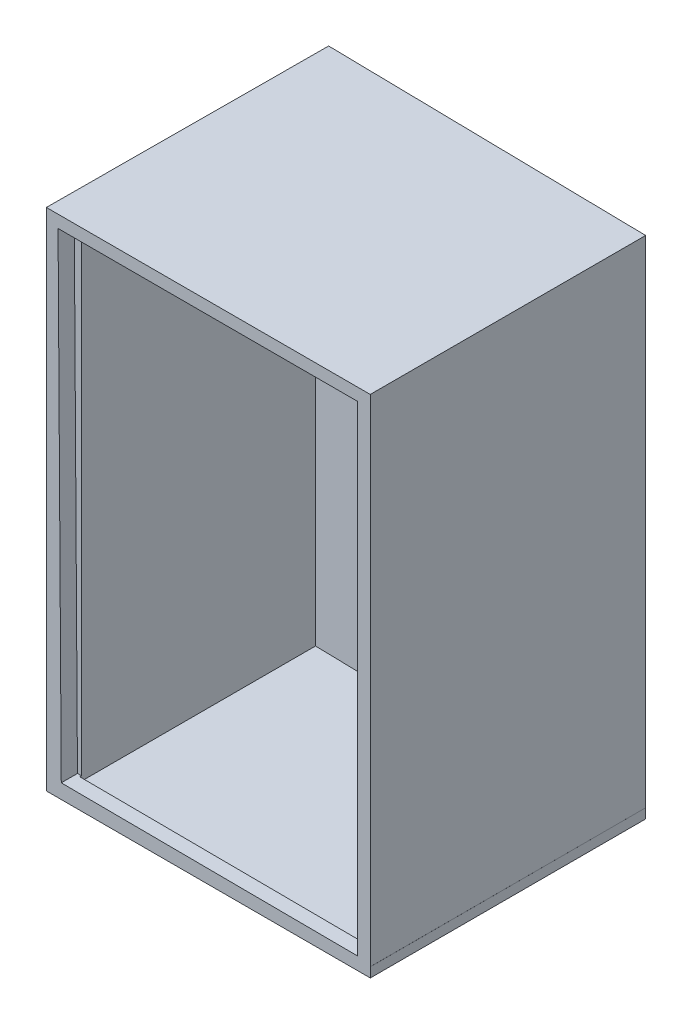
from build123d import *

# Parameters (mm, degrees)
BOSS_EXTRUDE1_DEPTH  = 3
BOSS_EXTRUDE3_DEPTH  = 150
BOSS_EXTRUDE4_DEPTH  = 3
CUT_EXTRUDE1_DEPTH   = 5
SKETCH6_W            = 55.881383125
SKETCH6_H            = 131.694311499
CUT_EXTRUDE3_DEPTH   = 19
SKETCH7_W            = 11.810965499
SKETCH7_H            = 56.555160504
BOSS_EXTRUDE5_DEPTH  = 1
SKETCH8_W            = 9.430572128
SKETCH8_H            = 6.978385349
CUT_EXTRUDE4_DEPTH   = 1
SKETCH9_R            = 2.553462054
SKETCH9_R_2          = 2.527406692
SKETCH9_R_3          = 2.450578881
SKETCH9_R_4          = 2.393474957
SKETCH9_R_5          = 2.423501959
SKETCH9_R_6          = 2.218374128
SKETCH9_R_7          = 2.394320802
SKETCH9_R_8          = 2.316573099
SKETCH9_R_9          = 2.249840859
BOSS_EXTRUDE6_DEPTH  = 1
SKETCH10_W           = 5.275039684
SKETCH10_H           = 138.164085468
BOSS_EXTRUDE8_DEPTH  = 28
SKETCH11_W           = 5.203423545
SKETCH11_H           = 131.656440026
BOSS_EXTRUDE9_DEPTH  = 28
BOSS_EXTRUDE11_DEPTH = 1
BOSS_EXTRUDE12_DEPTH = 1
BOSS_EXTRUDE13_DEPTH = 1
BOSS_EXTRUDE14_DEPTH = 1
BOSS_EXTRUDE16_DEPTH = 1
BOSS_EXTRUDE17_DEPTH = 1
BOSS_EXTRUDE18_DEPTH = 1
BOSS_EXTRUDE19_DEPTH = 1
SKETCH24_R           = 0.207284526
BOSS_EXTRUDE20_DEPTH = 1
BOSS_EXTRUDE21_DEPTH = 1


with BuildPart() as part:
    # Sketch1 → Boss-Extrude1 (new body)
    with BuildSketch(Plane(origin=(0, 0, 0), x_dir=(1, 0, 0), z_dir=(0, 1, 0))):
        Polygon((-39.384781927, 34.745621882), (60.600258914, 33.015995311), (60.615218073, -51.984003373), (-39.384781927, -51.984003373), align=None)
    extrude(amount=BOSS_EXTRUDE1_DEPTH)

    # Sketch2 → Boss-Extrude3 (add)
    with BuildSketch(Plane(origin=(0, 3, 0), x_dir=(1, 0, 0), z_dir=(0, 1, 0))):
        Polygon((-39.384781927, 34.745621882), (60.600258914, 33.015995311), (60.595836951, -51.984003373), (-39.384781927, -51.984003373), align=None)
        Polygon((-33.590728292, 25.303502533), (54.790044156, 23.384540531), (54.790044156, -47.497414334), (-33.590728292, -47.497414334), align=None, mode=Mode.SUBTRACT)
    extrude(amount=BOSS_EXTRUDE3_DEPTH)

    # Sketch4 → Boss-Extrude4 (add)
    with BuildSketch(Plane(origin=(0, 153, 0), x_dir=(1, 0, 0), z_dir=(0, 1, 0))):
        Polygon((-38.96845801, 34.738419955), (60.600258914, 33.015995311), (60.595836951, -51.984003373), (-39.384781927, -51.984003373), align=None)
    extrude(amount=BOSS_EXTRUDE4_DEPTH)

    # Sketch5 → Cut-Extrude1 (cut)
    with BuildSketch(Plane.XY.offset(51.984003373)):
        Polygon((-35.776536927, 152.183917826), (56.654094714, 152.183917826), (56.654094714, 3.919369827), (-34.786647076, 4.474634491), align=None)
    extrude(amount=-CUT_EXTRUDE1_DEPTH, mode=Mode.SUBTRACT)

    # Sketch6 → Cut-Extrude3 (cut)
    with BuildSketch(Plane(origin=(0.533313623, 0, -24.562586404), x_dir=(0.999764368337665, 0, 0.021707321400619532), z_dir=(-0.021707321400619536, 0, 0.999764368337665))):
        with Locations((10.253451121, 68.969395882)):
            Rectangle(SKETCH6_W, SKETCH6_H)
    extrude(amount=-CUT_EXTRUDE3_DEPTH, mode=Mode.SUBTRACT)

    # Sketch7 → Boss-Extrude5 (add)
    with BuildSketch(Plane(origin=(0.533313623, 0, -24.562586404), x_dir=(0.999764368337665, 0, 0.021707321400619532), z_dir=(-0.021707321400619536, 0, 0.999764368337665))):
        with Locations((46.937117149, 62.880310934)):
            Rectangle(SKETCH7_W, SKETCH7_H)
    extrude(amount=BOSS_EXTRUDE5_DEPTH)

    # Sketch8 → Cut-Extrude4 (cut)
    with BuildSketch(Plane(origin=(0.511606302, 0, -23.562822036), x_dir=(0.9997643683376649, 0, 0.02170732140061971), z_dir=(-0.021707321400619713, 0, 0.999764368337665))):
        with Locations((47.04819366, 84.912097217)):
            Rectangle(SKETCH8_W, SKETCH8_H)
    extrude(amount=-CUT_EXTRUDE4_DEPTH, mode=Mode.SUBTRACT)

    # Sketch9 → Boss-Extrude6 (add)
    with BuildSketch(Plane(origin=(0.511606302, 0, -23.562822036), x_dir=(0.9997643683376649, 0, 0.02170732140061971), z_dir=(-0.021707321400619713, 0, 0.999764368337665))):
        with Locations((44.220057391, 76.932607019)):
            Circle(SKETCH9_R)
        with Locations((49.787987313, 76.932607019)):
            Circle(SKETCH9_R_2)
        with Locations((44.220057391, 71.009067158)):
            Circle(SKETCH9_R_3)
        with Locations((49.997997577, 71.009067158)):
            Circle(SKETCH9_R_4)
        with Locations((46.605113113, 64.043550264)):
            Circle(SKETCH9_R_5)
        with Locations((46.605113113, 57.223700245)):
            Circle(SKETCH9_R_6)
        with Locations((46.605113113, 50.771174031)):
            Circle(SKETCH9_R_7)
        with Locations((46.605113113, 43.775541059)):
            Circle(SKETCH9_R_8)
        with Locations((46.605113113, 37.775832891)):
            Circle(SKETCH9_R_9)
    extrude(amount=BOSS_EXTRUDE6_DEPTH)

    # Sketch10 → Boss-Extrude8 (add)
    with BuildSketch(Plane(origin=(-17.683072767, 0, -0.383942613), x_dir=(0.021707321400619536, 0, -0.999764368337665), z_dir=(0.999764368337665, 0, 0.02170732140061954))):
        with Locations((31.343991402, 72.204282866)):
            Rectangle(SKETCH10_W, SKETCH10_H)
    extrude(amount=BOSS_EXTRUDE8_DEPTH)

    # Sketch11 → Boss-Extrude9 (add)
    with BuildSketch(Plane(origin=(10.310329546, 0, 0.223862386), x_dir=(0.021707321400619456, 0, -0.999764368337665), z_dir=(0.9997643683376649, 0, 0.021707321400619452))):
        with Locations((31.472273281, 68.988331618)):
            Rectangle(SKETCH11_W, SKETCH11_H)
    extrude(amount=BOSS_EXTRUDE9_DEPTH)

    # Sketch16 → Boss-Extrude11 (add)
    with BuildSketch(Plane(origin=(0.48989898, 0, -22.563057667), x_dir=(0.9997643683376649, 0, 0.021707321400619713), z_dir=(-0.021707321400619716, 0, 0.999764368337665))):
        with BuildLine():
            add(Edge.make_bspline(
                [(45.511628238, 63.885796638), (45.511956256, 63.941894026), (45.512593436, 64.05086401), (45.519681857, 64.209648652), (45.531457199, 64.358608941), (45.547594572, 64.497752007), (45.567232552, 64.627113772), (45.593448039, 64.746348529), (45.623260841, 64.856008136), (45.657813287, 64.956450184), (45.696801076, 65.049027887), (45.739235337, 65.135453088), (45.786800131, 65.215595021), (45.836777044, 65.290732811), (45.891189116, 65.359636506), (45.948487906, 65.423279169), (46.010909783, 65.480189919), (46.076332791, 65.532036221), (46.145349255, 65.577485693), (46.215991921, 65.617518432), (46.288747027, 65.651718299), (46.36381321, 65.678608735), (46.440515768, 65.700819582), (46.519122835, 65.716008529), (46.599764199, 65.725565438), (46.654195634, 65.726479105), (46.681800513, 65.726942472)],
                knots=[0, 0, 0, 0, 1.646270934, 3.197905019, 4.663502075, 6.030701355, 7.308322542, 8.50163776, 9.611534131, 10.641858119, 11.616356847, 12.558055219, 13.465016945, 14.349605745, 15.204443733, 16.039544428, 16.859896111, 17.680448484, 18.487036065, 19.28249412, 20.06191084, 20.843045899, 21.620316918, 22.403196591, 23.190181807, 24, 24, 24, 24], degree=3))
            add(Edge.make_bspline(
                [(46.681800513, 65.726942472), (46.709635992, 65.726454656), (46.764992001, 65.725484546), (46.846832376, 65.716160603), (46.926782058, 65.70068948), (47.004500196, 65.678768505), (47.080625183, 65.651572829), (47.15456159, 65.617485712), (47.226768672, 65.577806844), (47.29609896, 65.531182967), (47.363313575, 65.479200691), (47.426761538, 65.420438022), (47.486448624, 65.355488303), (47.543123929, 65.285046439), (47.595179526, 65.207761354), (47.644752959, 65.124977244), (47.689124995, 65.035246379), (47.73185967, 64.940065912), (47.768746657, 64.836802253), (47.802012902, 64.726037492), (47.82889187, 64.606463305), (47.851281143, 64.47870706), (47.868626039, 64.342299577), (47.881258681, 64.197533261), (47.887931766, 64.044312871), (47.889188467, 63.939555021), (47.889833366, 63.885796638)],
                knots=[0, 0, 0, 0, 0.810914788, 1.612654377, 2.396697861, 3.181598691, 3.963628158, 4.749916497, 5.551656086, 6.361998678, 7.18212741, 8.025565596, 8.878627764, 9.750805457, 10.657531673, 11.591944965, 12.560506719, 13.57287815, 14.630710178, 15.753379473, 16.941251878, 18.199788006, 19.531962791, 20.947069417, 22.433333509, 24, 24, 24, 24], degree=3))
            add(Edge.make_bspline(
                [(47.889833366, 63.885796638), (47.889181781, 63.83227273), (47.887912195, 63.727983579), (47.881333489, 63.575452603), (47.868374857, 63.43145456), (47.852164869, 63.295644097), (47.829713906, 63.168586479), (47.80210874, 63.04984203), (47.771458417, 62.938897958), (47.733623623, 62.836663147), (47.692212913, 62.741711424), (47.647157717, 62.653044276), (47.59888789, 62.569877983), (47.546299145, 62.492878236), (47.490245732, 62.421499579), (47.429527943, 62.357001956), (47.365857358, 62.297831284), (47.298444942, 62.245179657), (47.228033391, 62.199094852), (47.156074314, 62.157881002), (47.081290931, 62.124648307), (47.005377978, 62.096113266), (46.927249612, 62.074312814), (46.847003221, 62.059238958), (46.765046986, 62.04866711), (46.70964542, 62.04786063), (46.681800513, 62.047455292)],
                knots=[0, 0, 0, 0, 1.561518951, 3.042555995, 4.452378317, 5.7783523, 7.031515105, 8.214008947, 9.334062868, 10.386615937, 11.391082383, 12.354592575, 13.286541444, 14.194233754, 15.072674879, 15.931287219, 16.775624067, 17.606195743, 18.42308326, 19.229000347, 20.022332153, 20.807536673, 21.593273796, 22.3848459, 23.188221202, 24, 24, 24, 24], degree=3))
            add(Edge.make_bspline(
                [(46.681800513, 62.047455292), (46.654196399, 62.047921648), (46.599766475, 62.04884121), (46.519114049, 62.058354941), (46.440831606, 62.073650444), (46.364532852, 62.095067048), (46.289826337, 62.121281885), (46.21773005, 62.155435568), (46.147442366, 62.194769637), (46.07915081, 62.239565059), (46.014138649, 62.290886742), (45.952040044, 62.34765103), (45.894415025, 62.411274442), (45.840780929, 62.480752365), (45.789806841, 62.555445607), (45.742917468, 62.63637398), (45.699546614, 62.723216591), (45.659903123, 62.816534501), (45.624754459, 62.917689429), (45.593706751, 63.027838608), (45.569192594, 63.147954244), (45.548209638, 63.277071611), (45.531285255, 63.415745541), (45.51973093, 63.56405132), (45.512589615, 63.721896529), (45.511954545, 63.830166303), (45.511628238, 63.885796638)],
                knots=[0, 0, 0, 0, 0.810891512, 1.598919785, 2.382837074, 3.152667961, 3.926044502, 4.706494248, 5.493654104, 6.291793342, 7.103789334, 7.925228297, 8.761435821, 9.622817696, 10.50288917, 11.416980706, 12.369136599, 13.353924996, 14.394355917, 15.514179734, 16.714354668, 17.994756427, 19.357759367, 20.818452758, 22.365282078, 24, 24, 24, 24], degree=3))
        make_face()
        with BuildLine():
            add(Edge.make_bspline(
                [(45.825730802, 63.887198882), (45.825850249, 63.840450183), (45.826082072, 63.749720138), (45.832138273, 63.617876877), (45.840388505, 63.494906549), (45.851029802, 63.380653012), (45.86683275, 63.275503), (45.884539538, 63.178733316), (45.906087628, 63.090856079), (45.931582646, 63.011268269), (45.960621743, 62.9386192), (45.992327606, 62.871017985), (46.026388329, 62.807666049), (46.06450748, 62.74913244), (46.106022543, 62.695226276), (46.149995802, 62.644993444), (46.198068386, 62.600196462), (46.264572129, 62.546469607), (46.352368603, 62.490950474), (46.462989059, 62.442604384), (46.57665751, 62.412221927), (46.65380876, 62.408358172), (46.69231734, 62.406429651)],
                knots=[0, 0, 0, 0, 1.459021318, 2.831673884, 4.118529203, 5.306027144, 6.411944654, 7.436330062, 8.375795394, 9.233974572, 10.042671642, 10.816086306, 11.563610507, 12.285937304, 12.993564865, 13.685989202, 14.367179055, 15.041617293, 16.353048772, 17.594441528, 18.799311195, 20, 20, 20, 20], degree=3))
            add(Edge.make_bspline(
                [(46.69231734, 62.406429651), (46.731075012, 62.408027432), (46.808510335, 62.411219695), (46.92164413, 62.442018432), (47.0314744, 62.488487972), (47.117546341, 62.543435477), (47.183028884, 62.595763806), (47.229945874, 62.640378455), (47.273007923, 62.690334322), (47.313849997, 62.744233618), (47.351309073, 62.803106102), (47.385372211, 62.866668677), (47.416455558, 62.935097855), (47.434164604, 62.982867594), (47.443218783, 63.007291029)],
                knots=[0, 0, 0, 0, 1.353760809, 2.704726607, 4.075137775, 5.516104923, 6.260822281, 7.007110065, 7.778089737, 8.566572457, 9.372053459, 10.217411131, 11.088608312, 12, 12, 12, 12], degree=3))
            add(Edge.make_bspline(
                [(47.443218783, 63.007291029), (47.45377055, 63.038520769), (47.475195164, 63.101930533), (47.502806938, 63.200294185), (47.524552338, 63.303496949), (47.544115703, 63.410922066), (47.557468759, 63.523361767), (47.568216573, 63.640468151), (47.57454726, 63.762329513), (47.575332011, 63.845124504), (47.575730802, 63.887198882)],
                knots=[0, 0, 0, 0, 0.884706709, 1.796334032, 2.740027952, 3.714592787, 4.726048262, 5.777819803, 6.87074269, 8, 8, 8, 8], degree=3))
            add(Edge.make_bspline(
                [(47.575730802, 63.887198882), (47.575180613, 63.929266454), (47.574104325, 64.011559619), (47.569990337, 64.1320778), (47.559366763, 64.246545561), (47.547567644, 64.355456033), (47.530170423, 64.458206336), (47.511412616, 64.555656641), (47.486211403, 64.646599666), (47.459291629, 64.732459248), (47.428481233, 64.812259902), (47.394565499, 64.886373689), (47.35834374, 64.955158414), (47.319001499, 65.018425355), (47.277005816, 65.076457898), (47.231248267, 65.128092493), (47.183543894, 65.174929461), (47.116726709, 65.22839203), (47.029252419, 65.282903725), (46.920406771, 65.333069485), (46.807136127, 65.361877778), (46.730562673, 65.365939465), (46.69231734, 65.367968113)],
                knots=[0, 0, 0, 0, 1.31362396, 2.569729283, 3.763502607, 4.902122613, 5.988968491, 7.01645872, 7.998833611, 8.933434873, 9.825090667, 10.667526885, 11.477055099, 12.250526234, 12.991942729, 13.710640831, 14.402115721, 15.076753259, 16.378508321, 17.609869233, 18.806226677, 20, 20, 20, 20], degree=3))
            add(Edge.make_bspline(
                [(46.69231734, 65.367968113), (46.653606748, 65.365936666), (46.576115043, 65.361870072), (46.461667088, 65.333176818), (46.351962736, 65.283163852), (46.264719762, 65.22821148), (46.197855975, 65.175873168), (46.150773282, 65.130486714), (46.106627109, 65.08084046), (46.065959409, 65.026438545), (46.027870126, 64.967973178), (45.992889114, 64.904984413), (45.961371784, 64.837153049), (45.932287248, 64.764536614), (45.90671446, 64.684955669), (45.885620496, 64.597186676), (45.866133443, 64.500724784), (45.852338174, 64.395005276), (45.840074419, 64.280723122), (45.832193071, 64.157445804), (45.826061813, 64.025381424), (45.825843349, 63.934182265), (45.825730802, 63.887198882)],
                knots=[0, 0, 0, 0, 1.207732386, 2.417664972, 3.655092373, 4.956220595, 5.625982001, 6.301752483, 6.994047911, 7.697131622, 8.419323945, 9.170223765, 9.943494443, 10.752040957, 11.610060368, 12.549350801, 13.567764191, 14.679664412, 15.874934091, 17.154273443, 18.533957287, 20, 20, 20, 20], degree=3))
        make_face(mode=Mode.SUBTRACT)
    extrude(amount=BOSS_EXTRUDE11_DEPTH)

    # Sketch17 → Boss-Extrude12 (add)
    with BuildSketch(Plane(origin=(0.48989898, 0, -22.563057667), x_dir=(0.9997643683376649, 0, 0.021707321400619713), z_dir=(-0.021707321400619716, 0, 0.999764368337665))):
        Polygon((46.132027717, 58.964613684), (46.779163133, 58.964613684), (46.779163133, 55.464613684), (46.465060569, 55.464613684), (46.465060569, 58.605639325), (45.926599031, 58.605639325), align=None)
    extrude(amount=BOSS_EXTRUDE12_DEPTH)

    # Sketch18 → Boss-Extrude13 (add)
    with BuildSketch(Plane(origin=(0.48989898, 0, -22.563057667), x_dir=(0.9997643683376649, 0, 0.021707321400619713), z_dir=(-0.021707321400619716, 0, 0.999764368337665))):
        with BuildLine():
            Line((45.889261829, 51.554830758), (45.575159265, 51.554830758))
            add(Edge.make_bspline(
                [(45.575159265, 51.554830758), (45.577206418, 51.596501646), (45.581226972, 51.67834216), (45.600055262, 51.797666067), (45.626996139, 51.911720865), (45.665087593, 52.019590779), (45.712393871, 52.122229587), (45.769123898, 52.219229602), (45.836317749, 52.310220791), (45.912524483, 52.394359634), (45.995293122, 52.471547205), (46.084599061, 52.538202448), (46.178444088, 52.594520119), (46.276543487, 52.641601361), (46.380004051, 52.676941207), (46.487886909, 52.703162847), (46.600666045, 52.718939192), (46.677506067, 52.720634978), (46.716585547, 52.721497425)],
                knots=[0, 0, 0, 0, 1.10065271, 2.161652631, 3.183658789, 4.190468796, 5.17591951, 6.163126047, 7.15150782, 8.156236427, 9.156009102, 10.134482811, 11.092018607, 12.041330605, 13.001268258, 13.972401359, 14.968799086, 16, 16, 16, 16], degree=3))
            add(Edge.make_bspline(
                [(46.716585547, 52.721497425), (46.754963621, 52.720598968), (46.830375166, 52.718833533), (46.940437181, 52.703672504), (47.045214475, 52.679926913), (47.144502242, 52.646611496), (47.237508306, 52.601827069), (47.324931351, 52.54802953), (47.407812161, 52.485809699), (47.482418945, 52.412555885), (47.550927024, 52.334353501), (47.610029279, 52.250865597), (47.660642443, 52.164636312), (47.702830123, 52.07500811), (47.733886262, 51.981137082), (47.75746447, 51.884389879), (47.770791883, 51.783765068), (47.772837307, 51.715658512), (47.773877214, 51.681032681)],
                knots=[0, 0, 0, 0, 1.111607364, 2.184268762, 3.212621178, 4.221274766, 5.211760367, 6.196651075, 7.1921475, 8.207485113, 9.220403448, 10.201281604, 11.166441695, 12.114753415, 13.065576456, 14.026450734, 14.996634279, 16, 16, 16, 16], degree=3))
            add(Edge.make_bspline(
                [(47.773877214, 51.681032681), (47.772183951, 51.632284847), (47.76882714, 51.535644633), (47.740112763, 51.39362977), (47.695266252, 51.256036351), (47.641268895, 51.145299049), (47.586796451, 51.056065555), (47.537708944, 50.98259685), (47.480244133, 50.903491382), (47.413565635, 50.819014044), (47.339052763, 50.728503139), (47.256030599, 50.632013344), (47.163907117, 50.530541574), (47.099248616, 50.461235973), (47.065744201, 50.425323546)],
                knots=[0, 0, 0, 0, 1.184426356, 2.348067706, 3.509069118, 4.696110526, 5.333549288, 6.050745305, 6.844228056, 7.710549037, 8.667450064, 9.695053472, 10.805634456, 12, 12, 12, 12], degree=3))
            Line((47.065744201, 50.425323546), (46.190043079, 49.490728194))
            Line((46.190043079, 49.490728194), (47.818749009, 49.490728194))
            Line((47.818749009, 49.490728194), (47.818749009, 49.131753835))
            Line((47.818749009, 49.131753835), (45.440543881, 49.131753835))
            Line((45.440543881, 49.131753835), (46.797915676, 50.580271463))
            add(Edge.make_bspline(
                [(46.797915676, 50.580271463), (46.830963562, 50.61476977), (46.89444179, 50.681033956), (46.984224366, 50.777776916), (47.064863355, 50.867526457), (47.136880747, 50.950113006), (47.198714253, 51.026744573), (47.253586485, 51.094939277), (47.297552076, 51.157693727), (47.345267471, 51.230434341), (47.391481453, 51.319246658), (47.431193809, 51.427780348), (47.455408657, 51.5395076), (47.458313493, 51.615009637), (47.45977465, 51.652987809)],
                knots=[0, 0, 0, 0, 1.329631726, 2.553950428, 3.673215718, 4.687767853, 5.603093632, 6.413772471, 7.123043292, 7.734684054, 8.834405432, 9.900288307, 10.943827018, 12, 12, 12, 12], degree=3))
            add(Edge.make_bspline(
                [(47.45977465, 51.652987809), (47.459138908, 51.676869208), (47.457885982, 51.723934858), (47.446828284, 51.792940617), (47.430117778, 51.859505431), (47.40617252, 51.92383405), (47.37456578, 51.985279702), (47.3360924, 52.043917182), (47.291702337, 52.100606148), (47.240351067, 52.153759446), (47.183939547, 52.202440651), (47.124345298, 52.245564736), (47.061295194, 52.281603847), (46.995055071, 52.311147344), (46.925809602, 52.334322726), (46.853424857, 52.350381305), (46.778100841, 52.360463789), (46.726667345, 52.361827961), (46.700459746, 52.362523066)],
                knots=[0, 0, 0, 0, 0.991446411, 1.95395049, 2.89581595, 3.838931463, 4.798493298, 5.75982156, 6.748411868, 7.785213223, 8.824556874, 9.840280684, 10.836137867, 11.835679398, 12.848801643, 13.863922112, 14.911575587, 16, 16, 16, 16], degree=3))
            add(Edge.make_bspline(
                [(46.700459746, 52.362523066), (46.673088913, 52.361808033), (46.619337117, 52.360403828), (46.540418084, 52.350581164), (46.465132307, 52.333635324), (46.393290404, 52.310458649), (46.324770818, 52.281000101), (46.259906774, 52.244308356), (46.198843885, 52.200524863), (46.141467361, 52.150884306), (46.088603382, 52.095616705), (46.042156506, 52.034006742), (46.001572492, 51.967179327), (45.966163259, 51.895314776), (45.937407569, 51.817760996), (45.915434418, 51.734793291), (45.898047571, 51.64677191), (45.892239051, 51.585986825), (45.889261829, 51.554830758)],
                knots=[0, 0, 0, 0, 1.031018746, 2.02475058, 2.990194455, 3.934040569, 4.864654155, 5.795059489, 6.735614925, 7.690564532, 8.649604399, 9.611025574, 10.590972636, 11.591080095, 12.624614302, 13.701020113, 14.821632451, 16, 16, 16, 16], degree=3))
        make_face()
    extrude(amount=BOSS_EXTRUDE13_DEPTH)

    # Sketch19 → Boss-Extrude14 (add)
    with BuildSketch(Plane(origin=(0.48989898, 0, -22.563057667), x_dir=(0.9997643683376649, 0, 0.021707321400619713), z_dir=(-0.021707321400619716, 0, 0.999764368337665))):
        with BuildLine():
            Line((45.987156578, 44.758891989), (45.673054014, 44.758891989))
            add(Edge.make_bspline(
                [(45.673054014, 44.758891989), (45.681563564, 44.794124473), (45.69819904, 44.863001098), (45.732896613, 44.961408359), (45.770695868, 45.05453188), (45.816084973, 45.140627954), (45.865593727, 45.221426856), (45.922316449, 45.295095981), (45.983636171, 45.363508946), (46.051461121, 45.424222184), (46.122589782, 45.479199913), (46.198024402, 45.52607497), (46.276247296, 45.566399123), (46.357800429, 45.599619355), (46.4429266, 45.624644879), (46.530856224, 45.642801684), (46.621819724, 45.654592799), (46.683567314, 45.655743562), (46.714921001, 45.656327887)],
                knots=[0, 0, 0, 0, 1.162005537, 2.271625781, 3.343758855, 4.383309926, 5.390229558, 6.379919256, 7.361854164, 8.333198761, 9.295911338, 10.242430842, 11.177959212, 12.116337295, 13.062827104, 14.020064771, 14.994644689, 16, 16, 16, 16], degree=3))
            add(Edge.make_bspline(
                [(46.714921001, 45.656327887), (46.760603743, 45.654948657), (46.850972754, 45.652220281), (46.983735801, 45.627305845), (47.11176262, 45.587880712), (47.233651868, 45.533406985), (47.3468703, 45.466219672), (47.447606487, 45.386254935), (47.534494998, 45.295055634), (47.607389375, 45.194323069), (47.664464375, 45.08666756), (47.706550748, 44.975867403), (47.732172429, 44.862185431), (47.735492986, 44.785428152), (47.737156578, 44.746972919)],
                knots=[0, 0, 0, 0, 1.083050992, 2.142477498, 3.193116406, 4.255571735, 5.30263384, 6.308962982, 7.297363603, 8.282367274, 9.249857812, 10.179914175, 11.08814088, 12, 12, 12, 12], degree=3))
            add(Edge.make_bspline(
                [(47.737156578, 44.746972919), (47.735992987, 44.709966124), (47.73371602, 44.63754957), (47.714382314, 44.531828073), (47.681846051, 44.432186472), (47.636776289, 44.33820531), (47.578434738, 44.25048047), (47.507762041, 44.168814579), (47.42425938, 44.092845421), (47.360980442, 44.049325948), (47.328402571, 44.026920836)],
                knots=[0, 0, 0, 0, 1.024540389, 2.004866551, 2.965041327, 3.920577974, 4.882998113, 5.874504559, 6.905732034, 8, 8, 8, 8], degree=3))
            add(Edge.make_bspline(
                [(47.328402571, 44.026920836), (47.365634326, 44.008942664), (47.4394012, 43.973322706), (47.53995173, 43.903466949), (47.631229605, 43.822810601), (47.682133324, 43.759867949), (47.707709462, 43.728242951)],
                knots=[0, 0, 0, 0, 1.015518401, 2.012035669, 3.001164323, 4, 4, 4, 4], degree=3))
            add(Edge.make_bspline(
                [(47.707709462, 43.728242951), (47.724550805, 43.705185199), (47.757957701, 43.659447283), (47.799193234, 43.585910857), (47.836602349, 43.511559368), (47.865752568, 43.434399962), (47.888326435, 43.355326948), (47.904462467, 43.274204552), (47.914486608, 43.190966529), (47.91592216, 43.134654049), (47.916643757, 43.106347919)],
                knots=[0, 0, 0, 0, 1.025084078, 2.033381695, 3.024893161, 4.013698104, 4.991890475, 5.976764909, 6.982997093, 8, 8, 8, 8], degree=3))
            add(Edge.make_bspline(
                [(47.916643757, 43.106347919), (47.914849244, 43.057338198), (47.911268662, 42.959549396), (47.879264587, 42.815074674), (47.829651347, 42.673849172), (47.759194411, 42.538774333), (47.673326902, 42.412393952), (47.571169578, 42.299317643), (47.453883169, 42.202119038), (47.32307752, 42.12090881), (47.181360392, 42.055990888), (47.0297848, 42.010933445), (46.870534746, 41.981587446), (46.761327448, 41.978440577), (46.705806417, 41.976840707)],
                knots=[0, 0, 0, 0, 0.955779014, 1.907060117, 2.875433937, 3.871313158, 4.872415639, 5.851225146, 6.836215519, 7.83643374, 8.849228613, 9.86973379, 10.916971861, 12, 12, 12, 12], degree=3))
            add(Edge.make_bspline(
                [(46.705806417, 41.976840707), (46.668387117, 41.977708921), (46.594758412, 41.979417275), (46.486514914, 41.991095876), (46.383193214, 42.012425881), (46.284653616, 42.041129187), (46.19080858, 42.077520929), (46.101944475, 42.122839627), (46.017514581, 42.176151129), (45.93831563, 42.238084717), (45.864357063, 42.307366056), (45.797604338, 42.385225066), (45.736944545, 42.47022247), (45.684001907, 42.563345526), (45.636364954, 42.663390784), (45.597183997, 42.771639282), (45.562698429, 42.887123304), (45.546664965, 42.967601044), (45.538438629, 43.008891989)],
                knots=[0, 0, 0, 0, 1.048658725, 2.063410685, 3.046034179, 4.001477787, 4.936774919, 5.862367409, 6.792675028, 7.730719943, 8.675894397, 9.627829632, 10.600096036, 11.597688215, 12.626045268, 13.701542398, 14.82072376, 16, 16, 16, 16], degree=3))
            Line((45.538438629, 43.008891989), (45.852541193, 43.008891989))
            add(Edge.make_bspline(
                [(45.852541193, 43.008891989), (45.860724485, 42.981942976), (45.876641697, 42.929524804), (45.903735995, 42.854084499), (45.934604267, 42.784926446), (45.967718826, 42.721543324), (46.002497272, 42.663310921), (46.041412197, 42.611769052), (46.081581342, 42.56465385), (46.111860696, 42.538109238), (46.126679815, 42.525117951)],
                knots=[0, 0, 0, 0, 1.198163088, 2.33053128, 3.407730985, 4.417276592, 5.372219308, 6.28897303, 7.162600585, 8, 8, 8, 8], degree=3))
            add(Edge.make_bspline(
                [(46.126679815, 42.525117951), (46.146276391, 42.510009617), (46.185409054, 42.479839585), (46.249177285, 42.441337957), (46.316242171, 42.407976931), (46.388056846, 42.382493236), (46.463071616, 42.360915575), (46.542498981, 42.346795056), (46.625638198, 42.337106884), (46.682405962, 42.336251953), (46.711415392, 42.335815066)],
                knots=[0, 0, 0, 0, 0.946170439, 1.889420265, 2.845303464, 3.807233317, 4.801018734, 5.828864929, 6.890507805, 8, 8, 8, 8], degree=3))
            add(Edge.make_bspline(
                [(46.711415392, 42.335815066), (46.744168894, 42.336430972), (46.808215541, 42.337635321), (46.901670401, 42.348711028), (46.990577848, 42.364841441), (47.073950774, 42.389754424), (47.152881281, 42.420535276), (47.226262931, 42.459183681), (47.295059037, 42.504528403), (47.358388443, 42.556067561), (47.41533395, 42.612489056), (47.465473463, 42.671502128), (47.508098125, 42.732857957), (47.542481703, 42.796896078), (47.569632253, 42.863351307), (47.588115454, 42.932410136), (47.600966969, 43.003507402), (47.602013581, 43.051836371), (47.602541193, 43.076199682)],
                knots=[0, 0, 0, 0, 1.217147791, 2.380027433, 3.494444702, 4.572153297, 5.609568379, 6.639424714, 7.649109417, 8.668170816, 9.669597737, 10.625200337, 11.543417969, 12.441394052, 13.322311151, 14.205496177, 15.095365482, 16, 16, 16, 16], degree=3))
            add(Edge.make_bspline(
                [(47.602541193, 43.076199682), (47.601010892, 43.108811021), (47.597957903, 43.173871429), (47.574649324, 43.269589003), (47.536310459, 43.361812416), (47.482637948, 43.448968206), (47.417302219, 43.529744107), (47.340937313, 43.60181559), (47.252909084, 43.661285681), (47.171889215, 43.702374337), (47.100124059, 43.730411412), (47.038708674, 43.749086377), (46.969952071, 43.764900032), (46.894685722, 43.779612304), (46.812342506, 43.792133652), (46.723012068, 43.802575468), (46.626676306, 43.810930509), (46.55998514, 43.814661604), (46.525618116, 43.816584297)],
                knots=[0, 0, 0, 0, 1.07054697, 2.135767047, 3.216561865, 4.33974944, 5.486079747, 6.621378074, 7.775625952, 8.963672916, 9.598146892, 10.304877434, 11.070270905, 11.915000392, 12.823868403, 13.805723172, 14.86925407, 16, 16, 16, 16], degree=3))
            Line((46.525618116, 43.816584297), (46.525618116, 44.175558656))
            add(Edge.make_bspline(
                [(46.525618116, 44.175558656), (46.568919282, 44.17629346), (46.653735628, 44.17773276), (46.777629933, 44.19514077), (46.896103245, 44.219221398), (47.006529987, 44.25610659), (47.107178701, 44.298946887), (47.194498303, 44.348799097), (47.26726545, 44.404213846), (47.325126522, 44.466046455), (47.36865575, 44.532361503), (47.400482548, 44.601478161), (47.419282874, 44.674002222), (47.421792541, 44.723496889), (47.423054014, 44.748375162)],
                knots=[0, 0, 0, 0, 1.321986639, 2.589447074, 3.816329219, 5.01088745, 6.139805852, 7.153945165, 8.075214402, 8.924034688, 9.728124013, 10.488707548, 11.240355623, 12, 12, 12, 12], degree=3))
            add(Edge.make_bspline(
                [(47.423054014, 44.748375162), (47.422639603, 44.766652908), (47.421815152, 44.803015615), (47.411417874, 44.856140683), (47.395793833, 44.907641629), (47.374314104, 44.95729944), (47.345563905, 45.004769713), (47.311157918, 45.050457162), (47.270189818, 45.094100941), (47.223244371, 45.134781261), (47.172832566, 45.173550498), (47.117582791, 45.206464135), (47.059160916, 45.234609197), (46.997502262, 45.257818699), (46.932406731, 45.275277987), (46.864180174, 45.287813829), (46.79269249, 45.295651484), (46.743920758, 45.2967799), (46.719127732, 45.297353528)],
                knots=[0, 0, 0, 0, 0.884392785, 1.759457502, 2.611959086, 3.489218968, 4.37281399, 5.2945488, 6.255912374, 7.266815255, 8.301784654, 9.332968512, 10.37626691, 11.440494194, 12.520033166, 13.637162961, 14.798855837, 16, 16, 16, 16], degree=3))
            add(Edge.make_bspline(
                [(46.719127732, 45.297353528), (46.679276064, 45.295962166), (46.601436487, 45.293244512), (46.48922157, 45.269441499), (46.384902236, 45.231463415), (46.30516357, 45.186130396), (46.246280995, 45.141379962), (46.204204057, 45.102297576), (46.162883547, 45.058864752), (46.12503787, 45.008406377), (46.086763893, 44.954339586), (46.051919332, 44.893915905), (46.01805964, 44.828711511), (45.99765709, 44.782615876), (45.987156578, 44.758891989)],
                knots=[0, 0, 0, 0, 1.472543308, 2.876219568, 4.221790263, 5.565193594, 6.249813518, 6.953379497, 7.687249741, 8.463570142, 9.283606569, 10.136032583, 11.040678096, 12, 12, 12, 12], degree=3))
        make_face()
    extrude(amount=BOSS_EXTRUDE14_DEPTH)

    # Sketch20 → Boss-Extrude16 (add)
    with BuildSketch(Plane(origin=(0.48989898, 0, -22.563057667), x_dir=(0.9997643683376649, 0, 0.021707321400619713), z_dir=(-0.021707321400619716, 0, 0.999764368337665))):
        Polygon((47.043080253, 39.571392263), (47.106882336, 39.571392263), (47.106882336, 37.14831534), (47.51072849, 37.14831534), (47.51072849, 36.789340981), (47.106882336, 36.789340981), (47.106882336, 35.981648674), (46.792779772, 35.981648674), (46.792779772, 36.789340981), (45.132523362, 36.789340981), align=None)
        Polygon((46.792779772, 37.14831534), (46.792779772, 38.668347392), (45.749510541, 37.14831534), align=None, mode=Mode.SUBTRACT)
    extrude(amount=BOSS_EXTRUDE16_DEPTH)

    # Sketch21 → Boss-Extrude17 (add)
    with BuildSketch(Plane(origin=(0.48989898, 0, -22.563057667), x_dir=(0.9997643683376649, 0, 0.021707321400619713), z_dir=(-0.021707321400619716, 0, 0.999764368337665))):
        with BuildLine():
            Line((51.579569557, 72.003861587), (51.310338788, 71.748653253))
            add(Edge.make_bspline(
                [(51.310338788, 71.748653253), (51.2616199, 71.794484116), (51.165343854, 71.885052979), (51.008383611, 72.002563975), (50.844619977, 72.103230075), (50.67490748, 72.185136311), (50.503448926, 72.250489072), (50.33252015, 72.297017212), (50.163874448, 72.326689749), (50.05170723, 72.330238119), (49.996436545, 72.331986587)],
                knots=[0, 0, 0, 0, 1.08915593, 2.152340314, 3.188132944, 4.216796309, 5.218260357, 6.173443236, 7.099959455, 8, 8, 8, 8], degree=3))
            add(Edge.make_bspline(
                [(49.996436545, 72.331986587), (49.962521845, 72.331572981), (49.894780404, 72.330746842), (49.79415846, 72.320202627), (49.694591823, 72.305037763), (49.596268448, 72.283095885), (49.498997162, 72.255286825), (49.40311627, 72.220501362), (49.308446915, 72.179946118), (49.215880834, 72.133083644), (49.12614033, 72.081603798), (49.041383495, 72.024555257), (48.961070096, 71.963766467), (48.88670967, 71.897715488), (48.817874484, 71.827000622), (48.752926112, 71.752937316), (48.694148816, 71.673502098), (48.641057651, 71.590156472), (48.593696033, 71.504364282), (48.551887379, 71.416951293), (48.516790291, 71.328207438), (48.489020836, 71.238021361), (48.466110182, 71.147090771), (48.449992575, 71.05478605), (48.440905852, 70.961008365), (48.439334072, 70.898211107), (48.438543916, 70.866642036)],
                knots=[0, 0, 0, 0, 1.02818874, 2.053710826, 3.065248034, 4.081641283, 5.106893873, 6.131558223, 7.173050175, 8.228653731, 9.27666206, 10.308777013, 11.325269123, 12.329503258, 13.32196095, 14.316845687, 15.314881793, 16.315733098, 17.311955233, 18.285320748, 19.252783886, 20.203351036, 21.145449891, 22.095197417, 23.042428769, 24, 24, 24, 24], degree=3))
            add(Edge.make_bspline(
                [(48.438543916, 70.866642036), (48.439299635, 70.834371218), (48.440809008, 70.769917705), (48.450469327, 70.673723632), (48.468397568, 70.57895823), (48.492365276, 70.485310097), (48.522346092, 70.392618849), (48.559718758, 70.301286339), (48.603984359, 70.211315948), (48.655220911, 70.123518331), (48.711407114, 70.037995307), (48.774350195, 69.957435786), (48.841210779, 69.880767008), (48.914424678, 69.809691245), (48.991644221, 69.742307348), (49.075176497, 69.680471826), (49.163378957, 69.622993603), (49.256386169, 69.570597084), (49.353188952, 69.523788548), (49.452445705, 69.482164652), (49.55447352, 69.447885315), (49.65873621, 69.419947211), (49.765109482, 69.397046913), (49.874133284, 69.382314433), (49.985005993, 69.371623602), (50.059744625, 69.370841932), (50.097398083, 69.370448125)],
                knots=[0, 0, 0, 0, 0.93586088, 1.869166235, 2.799637598, 3.729985548, 4.670839027, 5.622275134, 6.589130586, 7.576015415, 8.568469353, 9.55398029, 10.53834874, 11.515998671, 12.510579167, 13.508179873, 14.527009472, 15.561807829, 16.601455013, 17.643573243, 18.680854198, 19.719860599, 20.772568776, 21.833555941, 22.908541556, 24, 24, 24, 24], degree=3))
            add(Edge.make_bspline(
                [(50.097398083, 69.370448125), (50.14277643, 69.371396702), (50.231884188, 69.373259385), (50.36287063, 69.387759675), (50.488673701, 69.410406468), (50.608939904, 69.443572365), (50.723808925, 69.48587604), (50.833701866, 69.536871426), (50.937753525, 69.598514486), (51.036276698, 69.668088353), (51.127033884, 69.745603185), (51.208888008, 69.82924764), (51.280533497, 69.918615707), (51.343038197, 70.013181022), (51.394746851, 70.113726327), (51.437189646, 70.21975889), (51.469722938, 70.331326402), (51.483077912, 70.408418033), (51.489825968, 70.447371202)],
                knots=[0, 0, 0, 0, 1.13008108, 2.219097802, 3.278683437, 4.311054135, 5.322181354, 6.324827112, 7.324222904, 8.330512327, 9.32562643, 10.293043162, 11.24128371, 12.174520618, 13.111833804, 14.052305215, 15.015860969, 16, 16, 16, 16], degree=3))
            Line((51.489825968, 70.447371202), (50.323159301, 70.447371202))
            Line((50.323159301, 70.447371202), (50.323159301, 70.806345561))
            Line((50.323159301, 70.806345561), (51.803928532, 70.806345561))
            add(Edge.make_bspline(
                [(51.803928532, 70.806345561), (51.802222683, 70.739438072), (51.79888403, 70.608488031), (51.775465114, 70.41751776), (51.737648602, 70.237146066), (51.68598829, 70.067182995), (51.61911301, 69.907869402), (51.537740481, 69.759043536), (51.44056836, 69.621666855), (51.331057919, 69.494617851), (51.208157961, 69.381288639), (51.075189341, 69.281682701), (50.931932373, 69.197780086), (50.778522565, 69.129519424), (50.615462132, 69.076245429), (50.442373752, 69.038473852), (50.259492151, 69.015843889), (50.134155474, 69.012952509), (50.070054333, 69.011473766)],
                knots=[0, 0, 0, 0, 1.140356446, 2.231883559, 3.274166699, 4.278491846, 5.25512956, 6.21435461, 7.1637429, 8.11826594, 9.068280886, 10.0076534, 10.945064095, 11.891975133, 12.864533718, 13.863980011, 14.907571808, 16, 16, 16, 16], degree=3))
            add(Edge.make_bspline(
                [(50.070054333, 69.011473766), (50.030544198, 69.012042888), (49.952617477, 69.013165378), (49.837526549, 69.021142725), (49.725608928, 69.033423302), (49.616880919, 69.051968425), (49.510942577, 69.074683079), (49.408322992, 69.103769798), (49.30863125, 69.137438497), (49.211713265, 69.175734171), (49.118448718, 69.220105828), (49.028422201, 69.269415467), (48.941136075, 69.323408828), (48.85718491, 69.383019674), (48.776131289, 69.447802134), (48.698497845, 69.517886053), (48.623849967, 69.593057172), (48.577089503, 69.646436182), (48.553527891, 69.673332741)],
                knots=[0, 0, 0, 0, 1.107784379, 2.184907829, 3.233506516, 4.263428166, 5.276301166, 6.270063455, 7.25232949, 8.225834625, 9.190232166, 10.146266622, 11.1027726, 12.066435141, 13.031522626, 14.010570082, 14.99756817, 16, 16, 16, 16], degree=3))
            add(Edge.make_bspline(
                [(48.553527891, 69.673332741), (48.519341959, 69.716003394), (48.451537546, 69.800636411), (48.36425939, 69.936236355), (48.289857987, 70.076638215), (48.229490165, 70.222232844), (48.182352078, 70.372884057), (48.148545826, 70.528399348), (48.128738536, 70.688978978), (48.125884999, 70.797644243), (48.124441352, 70.8526196)],
                knots=[0, 0, 0, 0, 1.023165419, 2.029347347, 3.013907458, 3.994755782, 4.975994455, 5.96558838, 6.970761222, 8, 8, 8, 8], degree=3))
            add(Edge.make_bspline(
                [(48.124441352, 70.8526196), (48.12497359, 70.893785852), (48.126031302, 70.97559516), (48.138856818, 71.097052467), (48.157258236, 71.216353159), (48.184305291, 71.333399716), (48.218401556, 71.448270307), (48.260955042, 71.561018271), (48.310499938, 71.671710143), (48.368085434, 71.779584011), (48.432169893, 71.883208424), (48.501720114, 71.982166227), (48.577723714, 72.074655292), (48.658939513, 72.16184694), (48.746336504, 72.242645787), (48.839095927, 72.317799898), (48.93728927, 72.387410084), (49.04122545, 72.450379918), (49.149353135, 72.506943539), (49.261413136, 72.556532751), (49.377371247, 72.597516066), (49.496358725, 72.632289846), (49.619276225, 72.658004986), (49.745231762, 72.676653732), (49.874881874, 72.689414331), (49.962517903, 72.690440587), (50.006953372, 72.690960946)],
                knots=[0, 0, 0, 0, 1.008945113, 2.00506715, 2.99143336, 3.967273523, 4.948097931, 5.927297278, 6.919902385, 7.919676788, 8.923139349, 9.905703106, 10.883022732, 11.856032218, 12.825136022, 13.798837087, 14.781400844, 15.773989409, 16.776158564, 17.77167057, 18.775803737, 19.789618931, 20.80898985, 21.851988756, 22.910860228, 24, 24, 24, 24], degree=3))
            add(Edge.make_bspline(
                [(50.006953372, 72.690960946), (50.043191615, 72.690381454), (50.115047794, 72.68923239), (50.221973526, 72.681267742), (50.327246541, 72.668643861), (50.431022931, 72.651417074), (50.532949297, 72.627953384), (50.633316002, 72.599875099), (50.732268539, 72.567183276), (50.829496788, 72.52819443), (50.925654504, 72.483940805), (51.021276344, 72.434127383), (51.11603559, 72.377902378), (51.210096572, 72.315098843), (51.30405243, 72.246795425), (51.396417072, 72.171038601), (51.489420016, 72.090815845), (51.54922183, 72.033133661), (51.579569557, 72.003861587)],
                knots=[0, 0, 0, 0, 0.985871117, 1.954866573, 2.915460327, 3.869826059, 4.81536089, 5.759505086, 6.70452669, 7.649098992, 8.607881297, 9.583363685, 10.581137262, 11.603961102, 12.659522466, 13.73993555, 14.853081303, 16, 16, 16, 16], degree=3))
        make_face()
    extrude(amount=BOSS_EXTRUDE17_DEPTH)

    # Sketch22 → Boss-Extrude18 (add)
    with BuildSketch(Plane(origin=(0.48989898, 0, -22.563057667), x_dir=(0.9997643683376649, 0, 0.021707321400619713), z_dir=(-0.021707321400619716, 0, 0.999764368337665))):
        Polygon((43.228597608, 72.652083437), (45.202956582, 72.652083437), (45.202956582, 72.293109078), (43.542700172, 72.293109078), (43.542700172, 71.216186002), (45.202956582, 71.216186002), (45.202956582, 70.857211643), (43.542700172, 70.857211643), (43.542700172, 69.511057796), (45.202956582, 69.511057796), (45.202956582, 69.152083437), (43.228597608, 69.152083437), align=None)
    extrude(amount=BOSS_EXTRUDE18_DEPTH)

    # Sketch23 → Boss-Extrude19 (add)
    with BuildSketch(Plane(origin=(0.48989898, 0, -22.563057667), x_dir=(0.9997643683376649, 0, 0.021707321400619713), z_dir=(-0.021707321400619716, 0, 0.999764368337665))):
        with BuildLine():
            Line((48.610831644, 75.93100708), (50.768361988, 75.946649001))
            add(Edge.make_bspline(
                [(50.484445858, 77.897885152), (50.287329075, 76.889613845), (50.768361988, 75.946649001)],
                knots=[0, 0, 0, 1, 1, 1], degree=2))
            ThreePointArc((50.484445858, 77.897885152), (49.721180766, 78.228118042), (48.957915674, 77.897885152))
            add(Edge.make_bspline(
                [(48.957915674, 77.897885152), (49.159479682, 77.253965503), (49.029440938, 76.470221454), (48.610831644, 75.93100708)],
                knots=[0, 0, 0, 0, 1, 1, 1, 1], degree=3))
        make_face()
        with BuildLine():
            Line((49.391368937, 75.745309608), (50.050992595, 75.745309608))
            add(Edge.make_bspline(
                [(49.391368937, 75.745309608), (49.749043619, 75.079278681), (50.050992595, 75.745309608)],
                knots=[0, 0, 0, 1, 1, 1], degree=2))
        make_face()
        with BuildLine():
            ThreePointArc((50.153189944, 78.241306842), (49.745374124, 78.625962532), (49.337558304, 78.241306842))
            ThreePointArc((49.337558304, 78.241306842), (49.745374124, 78.310161119), (50.153189944, 78.241306842))
        make_face()
    extrude(amount=BOSS_EXTRUDE19_DEPTH)

    # Sketch24 → Boss-Extrude20 (add)
    with BuildSketch(Plane(origin=(0.48989898, 0, -22.563057667), x_dir=(0.9997643683376649, 0, 0.021707321400619713), z_dir=(-0.021707321400619716, 0, 0.999764368337665))):
        with Locations((44.095101125, 76.955009426)):
            Circle(SKETCH24_R)
        with BuildLine():
            add(Edge.make_bspline(
                [(43.887816598, 77.291564685), (43.976601893, 77.381033269), (43.702608181, 78.04113502), (44.768471065, 78.868579117), (42.028533731, 78.393315151), (43.736897504, 77.139484123), (43.887816598, 77.291564685)],
                knots=[0, 0, 0, 0, 0.186456971, 0.34847302, 0.683056556, 1, 1, 1, 1], degree=3))
        make_face()
        with BuildLine():
            add(Edge.make_bspline(
                [(44.470971326, 77.138087458), (44.508833469, 77.054724973), (45.137973053, 76.811404325), (44.632834453, 75.564986412), (46.945830495, 77.340537543), (44.382944399, 77.331899609), (44.470971326, 77.138087458)],
                knots=[0, 0, 0, 0, 0.155484348, 0.31961453, 0.638509387, 1, 1, 1, 1], degree=3))
        make_face()
        with BuildLine():
            add(Edge.make_bspline(
                [(44.045687531, 76.628942007), (43.957333097, 76.658462953), (43.383974056, 76.310475211), (42.423040004, 77.535130952), (43.126405372, 74.586463234), (44.246208781, 76.561943932), (44.045687531, 76.628942007)],
                knots=[0, 0, 0, 0, 0.137910138, 0.342606962, 0.687011598, 1, 1, 1, 1], degree=3))
        make_face()
    extrude(amount=BOSS_EXTRUDE20_DEPTH)

    # Sketch25 → Boss-Extrude21 (add)
    with BuildSketch(Plane(origin=(0.533313623, 0, -24.562586404), x_dir=(0.9997643683376649, 0, 0.02170732140061973), z_dir=(-0.021707321400619733, 0, 0.999764368337665))):
        Polygon((48.001382393, 86.282549301), (49.564184438, 86.282549301), (49.564184438, 83.78851939), (50.30133418, 83.78851939), (48.782783416, 82.36193166), (47.442589463, 83.78851939), (48.001382393, 83.78851939), align=None)
        Polygon((44.096583613, 86.420086576), (46.070942587, 86.420086576), (46.070942587, 86.061112217), (44.410686177, 86.061112217), (44.410686177, 84.98418914), (46.070942587, 84.98418914), (46.070942587, 84.625214781), (44.410686177, 84.625214781), (44.410686177, 83.279060935), (46.070942587, 83.279060935), (46.070942587, 82.920086576), (44.096583613, 82.920086576), align=None)
    extrude(amount=BOSS_EXTRUDE21_DEPTH)


solid = part.part
